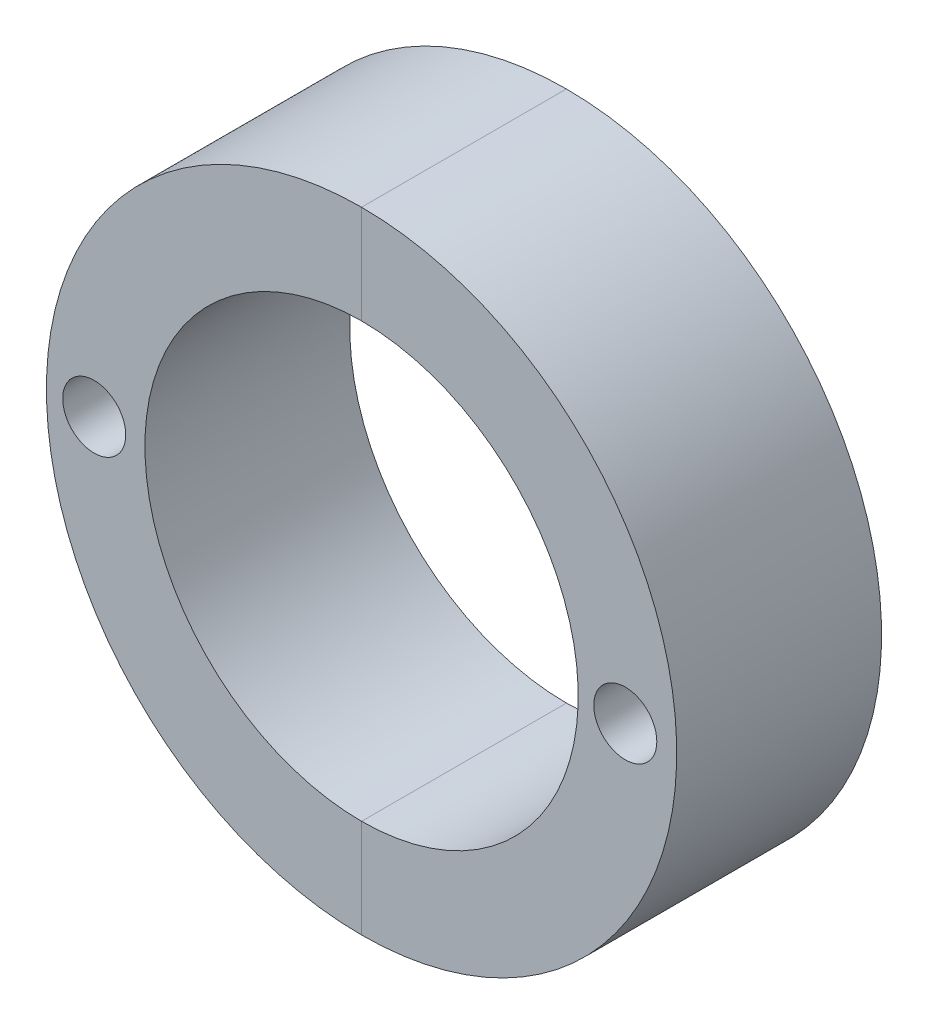
from build123d import *

# Parameters (mm, degrees)
SKETCH1_R              = 40
BOSS_EXTRUDE1_DEPTH    = 26
SKETCH2_R              = 27.5
CUT_EXTRUDE1_DEPTH     = 63.257529665
SPLIT1_SURFACE_1_BACK  = 117.086
SPLIT1_SURFACE_1_DEPTH = 234.172
SPLIT1_SURFACE_2_BACK  = 117.086
SPLIT1_SURFACE_2_DEPTH = 234.172
SKETCH4_R              = 4
CUT_EXTRUDE3_DEPTH     = 63.257529665


with BuildPart() as part:
    # Sketch1 → Boss-Extrude1 (new body)
    with BuildSketch(Plane.XY):
        Circle(SKETCH1_R)
    extrude(amount=BOSS_EXTRUDE1_DEPTH)

    # Sketch2 → Cut-Extrude1 (cut, through all)
    with BuildSketch(Plane.XY.offset(26)):
        Circle(SKETCH2_R)
    extrude(amount=-CUT_EXTRUDE1_DEPTH, mode=Mode.SUBTRACT)


with BuildPart() as body_2:
    # Split1: the piece behind the surface
    add(part.part)
    # Split1 surface: a surface, the sketch's curves swept straight by 234.172 mm
    with BuildLine(Plane.XY.offset(-SPLIT1_SURFACE_1_BACK), mode=Mode.PRIVATE) as split1_surface_1_path:
        Line((0, 44.406753527), (0, -43.858522002))
    split1_surface_1 = Shell.extrude(split1_surface_1_path.wire(), (0 * SPLIT1_SURFACE_1_DEPTH, 0 * SPLIT1_SURFACE_1_DEPTH, 1 * SPLIT1_SURFACE_1_DEPTH))
    split(bisect_by=split1_surface_1, keep=Keep.BOTTOM)


with BuildPart() as part_1:
    add(part.part)

    # Split1: split by a surface, the side it looks to stays
    # Split1 surface: a surface, the sketch's curves swept straight by 234.172 mm
    with BuildLine(Plane.XY.offset(-SPLIT1_SURFACE_2_BACK), mode=Mode.PRIVATE) as split1_surface_2_path:
        Line((0, 44.406753527), (0, -43.858522002))
    split1_surface_2 = Shell.extrude(split1_surface_2_path.wire(), (0 * SPLIT1_SURFACE_2_DEPTH, 0 * SPLIT1_SURFACE_2_DEPTH, 1 * SPLIT1_SURFACE_2_DEPTH))
    split(bisect_by=split1_surface_2, keep=Keep.TOP)


with BuildPart() as cut_extrude3_tool:
    # Sketch4 → Cut-Extrude3 (new, through all)
    with BuildSketch(Plane.XY.offset(26)):
        with Locations((-33.931678765, 0)):
            Circle(SKETCH4_R)
        with Locations((33.47196226, 0)):
            Circle(SKETCH4_R)
    extrude(amount=-CUT_EXTRUDE3_DEPTH)


with BuildPart() as part_2:
    add(part_1.part)

    # Cut-Extrude3: cut by cut_extrude3_tool
    add(cut_extrude3_tool.part, mode=Mode.SUBTRACT)


with BuildPart() as body_2_1:
    add(body_2.part)

    # Cut-Extrude3: cut by cut_extrude3_tool
    add(cut_extrude3_tool.part, mode=Mode.SUBTRACT)


solid = Compound([part_2.part, body_2_1.part])
